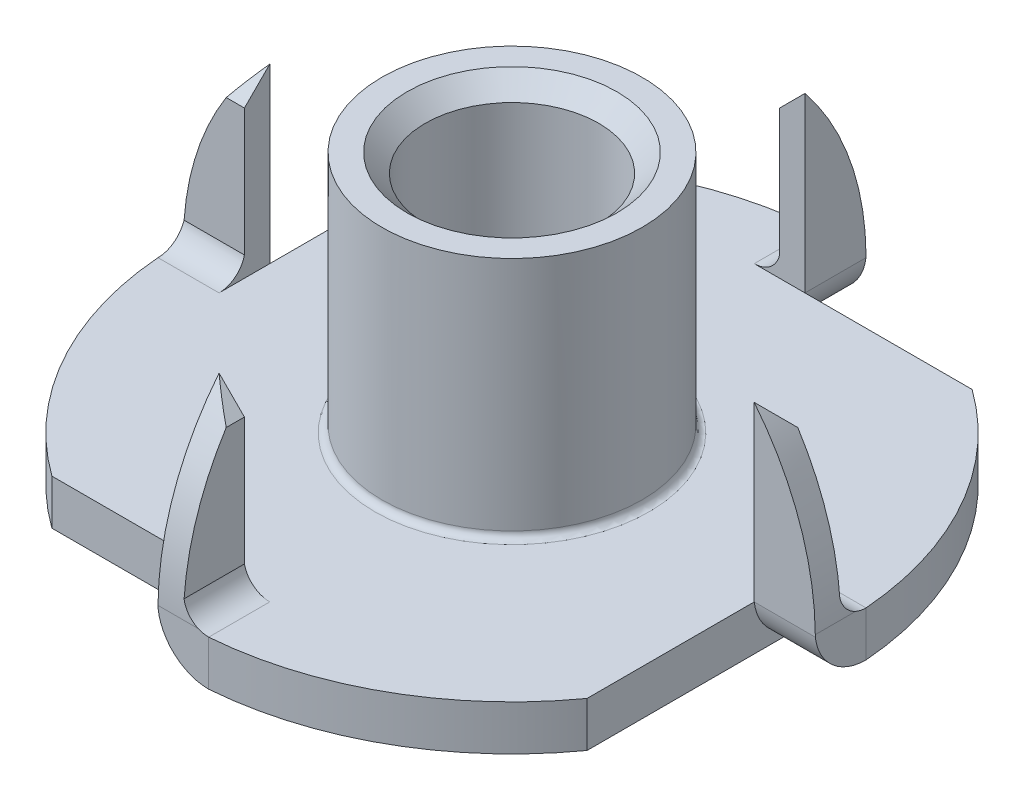
from build123d import *

# Parameters (mm, degrees)
BOSS_EXTRUDE1_DEPTH     = 1.3
BOSS_EXTRUDE2_DEPTH     = 1.76
CIRPATTERN1_COUNT       = 4
CUT_EXTRUDE2_DEPTH      = 15.794267561
CUT_EXTRUDE2_DEPTH_BACK = 15.794267561
CUT_EXTRUDE3_DEPTH      = 15.794267603
CUT_EXTRUDE3_DEPTH_BACK = 15.794267603
SKETCH8_W               = 3.75
SKETCH8_H               = 7
FILLET1_R               = 0.2


with BuildPart() as part:
    # Sketch1 → Boss-Extrude1 (new body)
    with BuildSketch(Plane(origin=(0, 0, 0), x_dir=(1, 0, 0), z_dir=(0, 1, 0))):
        with BuildLine():
            Line((-0.730769231, 7.71160656), (5.548073923, 7.71160656))
            ThreePointArc((5.548073923, 7.71160656), (8.281459084, 4.65482926), (9.47185179, 0.730769231))
            Line((9.47185179, 0.730769231), (7.71160656, 0.730769231))
            Line((7.71160656, 0.730769231), (7.71160656, -5.548073923))
            ThreePointArc((7.71160656, -5.548073923), (4.65482926, -8.281459084), (0.730769231, -9.47185179))
            Line((0.730769231, -9.47185179), (0.730769231, -7.71160656))
            Line((0.730769231, -7.71160656), (-5.548073923, -7.71160656))
            ThreePointArc((-5.548073923, -7.71160656), (-8.281459084, -4.65482926), (-9.47185179, -0.730769231))
            Line((-9.47185179, -0.730769231), (-7.71160656, -0.730769231))
            Line((-7.71160656, -0.730769231), (-7.71160656, 5.548073923))
            ThreePointArc((-7.71160656, 5.548073923), (-4.65482926, 8.281459084), (-0.730769231, 9.47185179))
            Line((-0.730769231, 9.47185179), (-0.730769231, 7.71160656))
        make_face()
    extrude(amount=BOSS_EXTRUDE1_DEPTH)

    # Sketch2 → Boss-Extrude2 (add)
    with BuildSketch(Plane(origin=(0, 0, -7.71160656), x_dir=(-1, 0, 0), z_dir=(0, 0, -1))):
        with BuildLine():
            Line((-0.730769231, 6.28), (-0.730769231, 1.3))
            ThreePointArc((-0.730769231, 1.3), (-0.24725105, 0.372025447), (0.730769231, 0))
            Line((0.730769231, 0), (0.730769231, 1.3))
            ThreePointArc((0.730769231, 1.3), (0.26383811, 1.463095229), (0, 1.881442187))
            Line((0, 1.881442187), (0, 5.549230769))
            Line((0, 5.549230769), (-0.730769231, 6.28))
        make_face()
    boss_extrude2 = extrude(amount=BOSS_EXTRUDE2_DEPTH)

    # CirPattern1: Boss-Extrude2 ×4 about axis
    cirpattern1_axis = Axis((0, 0, 0), (0, 1, 0))
    for i in range(1, CIRPATTERN1_COUNT):
        add(boss_extrude2.rotate(cirpattern1_axis, i * 360 / CIRPATTERN1_COUNT))

    # Sketch6 → Cut-Extrude2 (cut, two sides: drawn at the far end of the back side and taken through both)
    with BuildSketch(Plane(origin=(0, 0, 0), x_dir=(0, 0, -1), z_dir=(1, 0, 0)).offset(-CUT_EXTRUDE2_DEPTH_BACK)):
        with BuildLine():
            Line((-7.71160656, 6.28), (-9.47160656, 6.28))
            Line((-9.47160656, 6.28), (-9.47185179, 1.3))
            ThreePointArc((-9.47185179, 1.3), (-9.018842539, 3.940968727), (-7.71160656, 6.28))
        make_face()
        with BuildLine():
            Line((7.71160656, 6.28), (9.47160656, 6.28))
            Line((9.47160656, 6.28), (9.47185179, 1.3))
            ThreePointArc((9.47185179, 1.3), (9.018842539, 3.940968727), (7.71160656, 6.28))
        make_face()
    extrude(amount=CUT_EXTRUDE2_DEPTH + CUT_EXTRUDE2_DEPTH_BACK, mode=Mode.SUBTRACT)

    # Sketch7 → Cut-Extrude3 (cut, two sides: drawn at the far end of the back side and taken through both)
    with BuildSketch(Plane.XY.offset(-CUT_EXTRUDE3_DEPTH_BACK)):
        with BuildLine():
            Line((-9.47160656, 6.28), (-7.71160656, 6.28))
            ThreePointArc((-7.71160656, 6.28), (-9.018842539, 3.940968727), (-9.47185179, 1.3))
            Line((-9.47185179, 1.3), (-9.47160656, 6.28))
        make_face()
        with BuildLine():
            Line((9.47160656, 6.28), (7.71160656, 6.28))
            ThreePointArc((7.71160656, 6.28), (9.018842539, 3.940968727), (9.47185179, 1.3))
            Line((9.47185179, 1.3), (9.47160656, 6.28))
        make_face()
    extrude(amount=CUT_EXTRUDE3_DEPTH + CUT_EXTRUDE3_DEPTH_BACK, mode=Mode.SUBTRACT)

    # Sketch8 → Revolve1 (revolve)
    with BuildSketch(Plane.XY):
        with Locations((1.875, 4.8)):
            Rectangle(SKETCH8_W, SKETCH8_H)
    revolve(axis=Axis((0, 1.3, 0), (0, 1, 0)))

    # Fillet1
    fillet1_edges = [part.edges().sort_by_distance(p)[0] for p in [
        (-3.75, 1.3, 0),
    ]]
    fillet(fillet1_edges, radius=FILLET1_R)

    # Sketch10 → M6 Tapped Hole1 (revolve, cut)
    with BuildSketch(Plane(origin=(0, 0, 0), x_dir=(0, 0, -1), z_dir=(1, 0, 0))):
        Polygon((0, 0), (0, 8.3), (3.025, 8.3), (2.5, 7.775), (2.5, 0.525), (3.025, 0), align=None)
    revolve(axis=Axis((0, -6.35, 0), (0, 1, 0)), mode=Mode.SUBTRACT)


solid = part.part
